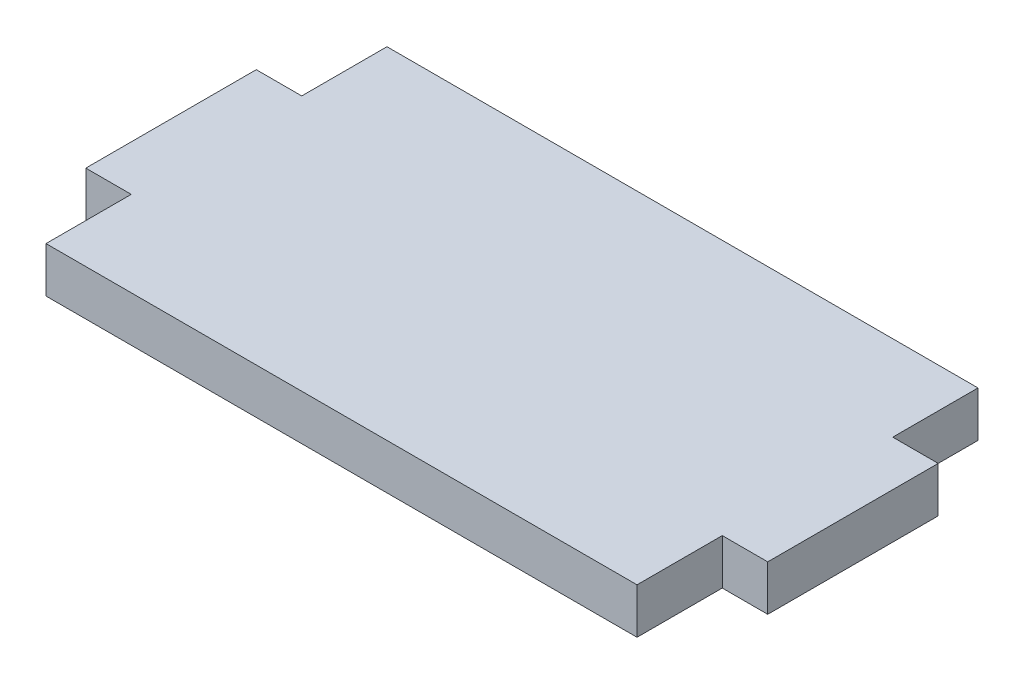
from build123d import *

# Parameters (mm, degrees)
AUFSATZ_LINEAR_AUSTRAGEN1_DEPTH = 4


with BuildPart() as part:
    # Skizze1 → Aufsatz-Linear austragen1 (new body)
    with BuildSketch(Plane(origin=(0, 0, 0), x_dir=(1, 0, 0), z_dir=(0, 1, 0))):
        Polygon((26, -15), (-26, -15), (-26, -7.5), (-30, -7.5), (-30, 7.5), (-26, 7.5), (-26, 15), (26, 15), (26, 7.5), (30, 7.5), (30, -7.5), (26, -7.5), align=None)
    extrude(amount=AUFSATZ_LINEAR_AUSTRAGEN1_DEPTH)


solid = part.part
